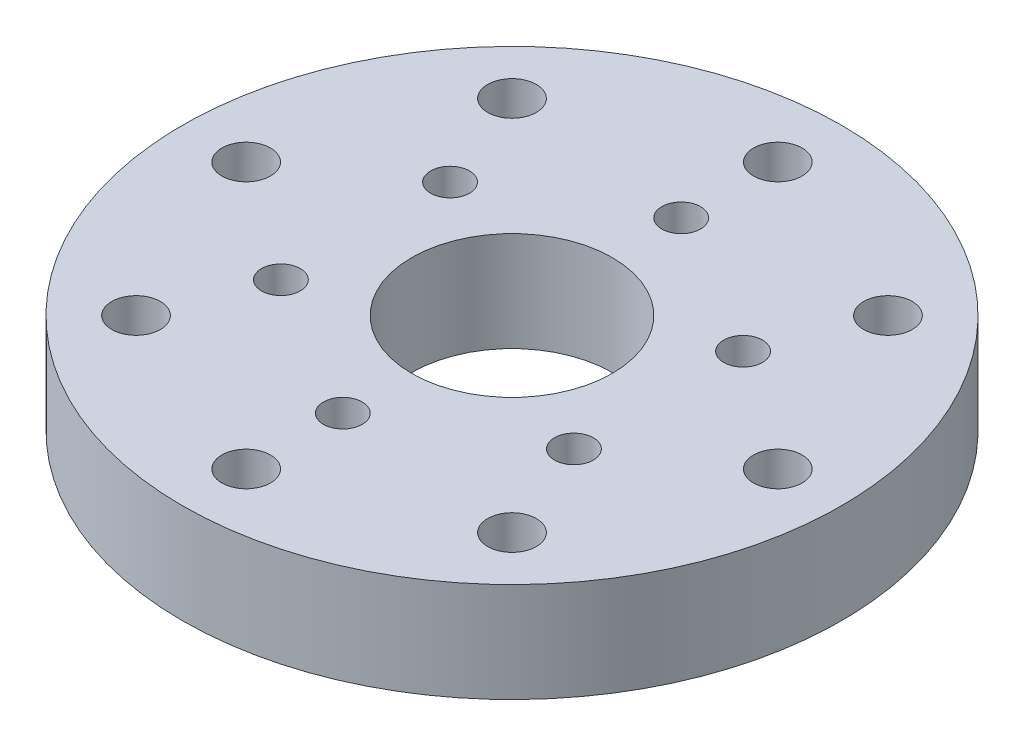
from build123d import *

# Parameters (mm, degrees)
SKETCH1_R          = 57.15
EXTRUDE1_DEPTH     = 17.272
SKETCH2_R          = 17.399
CUT_EXTRUDE1_DEPTH = 22.352
SKETCH3_R          = 3.3655
CUT_EXTRUDE3_DEPTH = 22.352
CIRPATTERN1_COUNT  = 6
SKETCH4_R          = 4.2164
CUT_EXTRUDE4_DEPTH = 22.352
CIRPATTERN2_COUNT  = 8


with BuildPart() as part:
    # Sketch1 → Extrude1 (new body)
    with BuildSketch(Plane(origin=(0, 0, 0), x_dir=(1, 0, 0), z_dir=(0, 1, 0))):
        Circle(SKETCH1_R)
    extrude(amount=EXTRUDE1_DEPTH)

    # Sketch2 → Cut-Extrude1 (cut)
    with BuildSketch(Plane(origin=(0, 0, 0), x_dir=(1, 0, 0), z_dir=(0, 1, 0))):
        Circle(SKETCH2_R)
    extrude(amount=CUT_EXTRUDE1_DEPTH, mode=Mode.SUBTRACT)

    # Sketch3 → Cut-Extrude3 (cut)
    with BuildSketch(Plane(origin=(0, 0, 0), x_dir=(1, 0, 0), z_dir=(0, 1, 0))):
        with Locations((0, 29.337)):
            Circle(SKETCH3_R)
    cut_extrude3 = extrude(amount=CUT_EXTRUDE3_DEPTH, mode=Mode.SUBTRACT)

    # CirPattern1: Cut-Extrude3 ×6 about axis
    cirpattern1_axis = Axis((0, 103.923475146, 0), (0, -1, 0))
    for i in range(1, CIRPATTERN1_COUNT):
        add(cut_extrude3.rotate(cirpattern1_axis, i * 360 / CIRPATTERN1_COUNT), mode=Mode.SUBTRACT)

    # Sketch4 → Cut-Extrude4 (cut)
    with BuildSketch(Plane(origin=(0, 0, 0), x_dir=(1, 0, 0), z_dir=(0, 1, 0))):
        with Locations((0, 46.101)):
            Circle(SKETCH4_R)
    cut_extrude4 = extrude(amount=CUT_EXTRUDE4_DEPTH, mode=Mode.SUBTRACT)

    # CirPattern2: Cut-Extrude4 ×8 about axis
    cirpattern2_axis = Axis((0, 103.923475146, 0), (0, -1, 0))
    for i in range(1, CIRPATTERN2_COUNT):
        add(cut_extrude4.rotate(cirpattern2_axis, i * 360 / CIRPATTERN2_COUNT), mode=Mode.SUBTRACT)


solid = part.part
